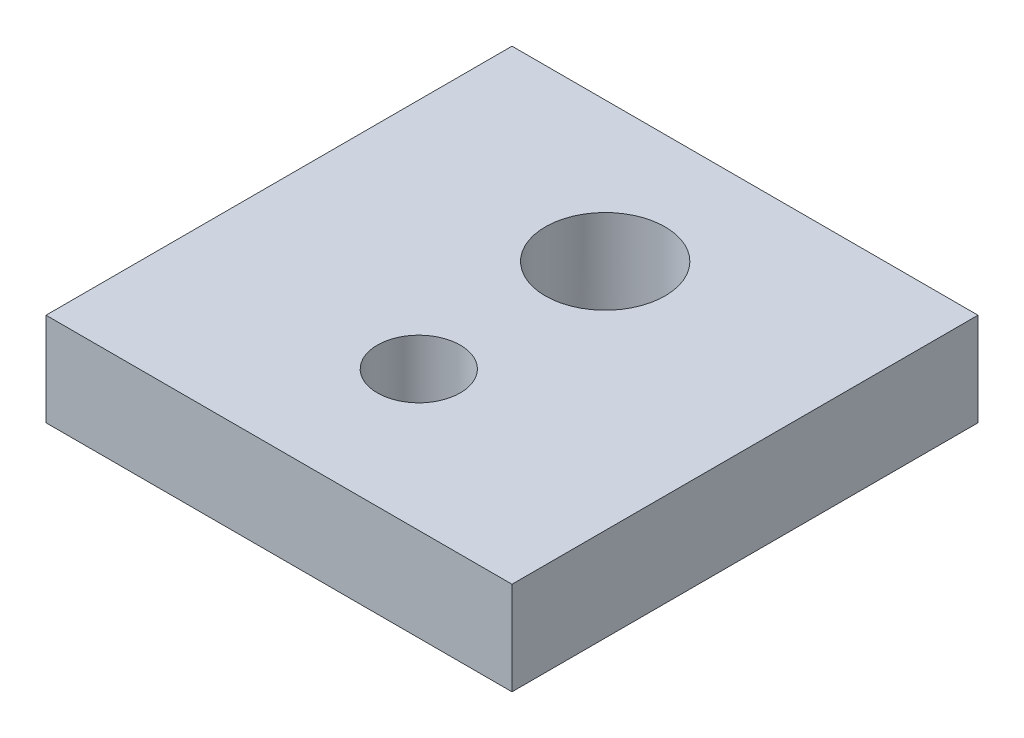
from build123d import *

# Parameters (mm, degrees)
SKETCH1_W                 = 12.7
SKETCH1_H                 = 12.7
BOSS_EXTRUDE1_DEPTH       = 2.54
F_4_CLEARANCE_HOLE1_D     = 3.2639
TAP_DRILL_FOR_4_40_TAP1_D = 2.2606


with BuildPart() as part:
    # Sketch1 → Boss-Extrude1 (new body)
    with BuildSketch(Plane(origin=(0, 0, 0), x_dir=(1, 0, 0), z_dir=(0, 1, 0))):
        Rectangle(SKETCH1_W, SKETCH1_H)
    extrude(amount=BOSS_EXTRUDE1_DEPTH)

    # #4 Clearance Hole1 (through all)
    with Locations(Plane(origin=(0, 2.54, -2.54), x_dir=(0, 0, 1), z_dir=(0, 1, 0))):
        with Locations((0, 0)):
            Hole(F_4_CLEARANCE_HOLE1_D / 2)

    # Tap Drill for #4-40 Tap1 (through all)
    with Locations(Plane(origin=(0, 2.54, 2.54), x_dir=(0, 0, 1), z_dir=(0, 1, 0))):
        with Locations((0, 0)):
            Hole(TAP_DRILL_FOR_4_40_TAP1_D / 2)


solid = part.part
